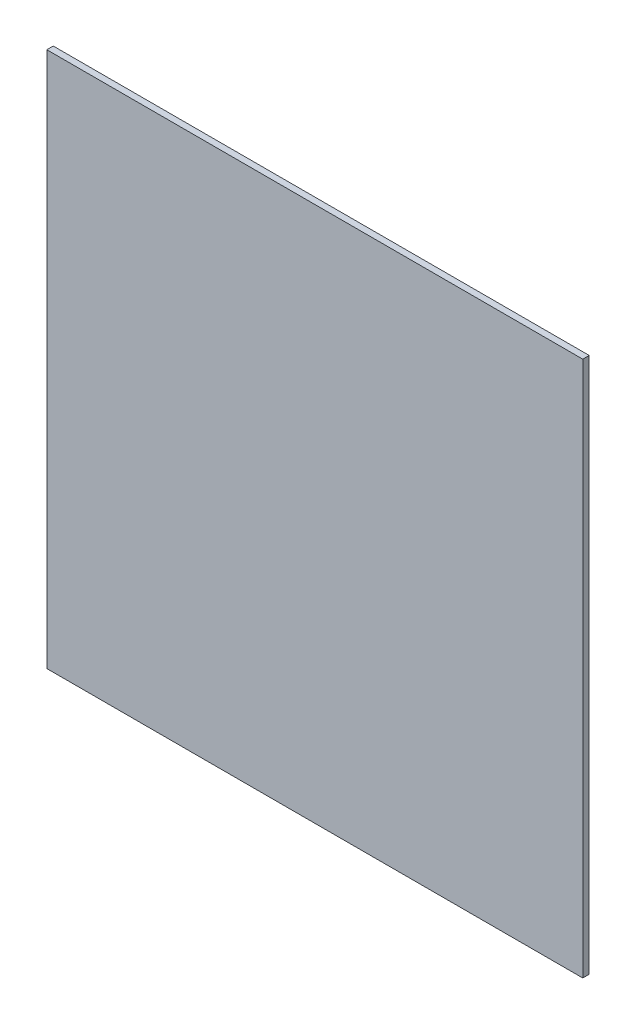
from build123d import *

# Parameters (mm, degrees)
SKETCH_1_W      = 300
SKETCH_1_H      = 300
EXTRUDE_1_DEPTH = 3.6


with BuildPart() as part:
    # 草图1 → 凸台-拉伸1 (new body)
    with BuildSketch(Plane.XY):
        Rectangle(SKETCH_1_W, SKETCH_1_H)
    extrude(amount=EXTRUDE_1_DEPTH)


solid = part.part
